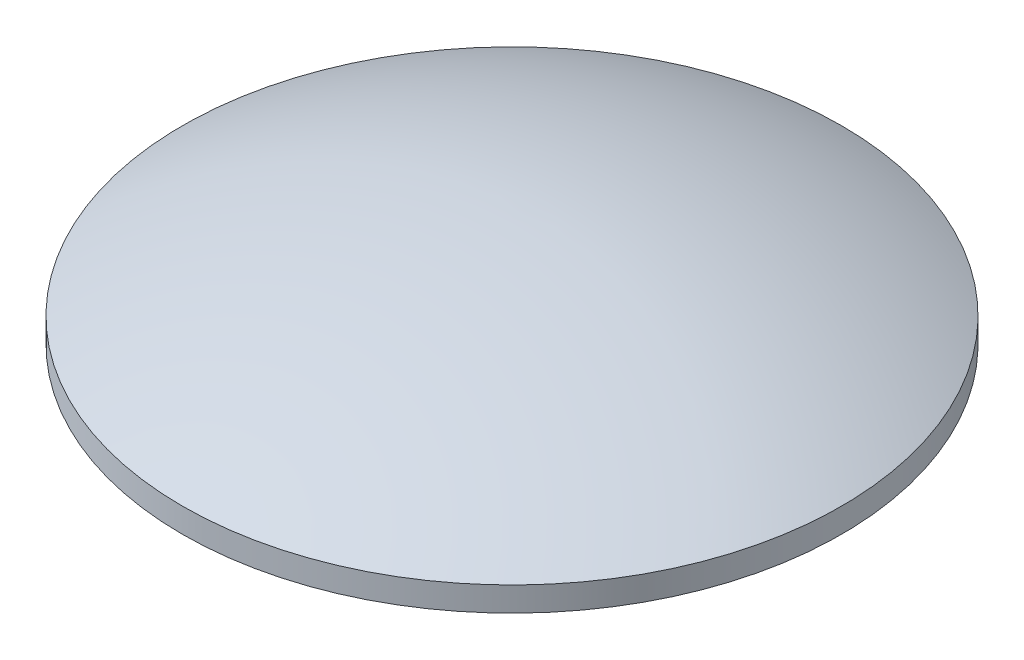
from build123d import *

# Parameters (mm, degrees)
SKETCH2_R           = 6.75
BOSS_EXTRUDE1_DEPTH = 0.5
DOME1_FACE_RADIUS   = 6.75
DOME1_HEIGHT        = 1.7


with BuildPart() as part:
    # Sketch2 → Boss-Extrude1 (new body)
    with BuildSketch(Plane(origin=(0, 0, 0), x_dir=(1, 0, 0), z_dir=(0, 1, 0))):
        with Locations(Location((0, 0, 0), (0, 0, 270))):
            Circle(SKETCH2_R)
    extrude(amount=BOSS_EXTRUDE1_DEPTH)

    # Dome1: a dome of height H over a round flat face of radius A is a cap of a sphere of radius (A * A + H * H) / (2 * H)
    dome1_r = (DOME1_FACE_RADIUS * DOME1_FACE_RADIUS + DOME1_HEIGHT * DOME1_HEIGHT) / (2 * DOME1_HEIGHT)
    dome1_base = Plane((0, 0.5, 0), z_dir=(0, 1, 0))
    with Locations(dome1_base.offset(DOME1_HEIGHT - dome1_r)):
        dome1_ball = Sphere(dome1_r, mode=Mode.PRIVATE)
    add(split(dome1_ball, bisect_by=dome1_base, keep=Keep.TOP, mode=Mode.PRIVATE))


solid = part.part
